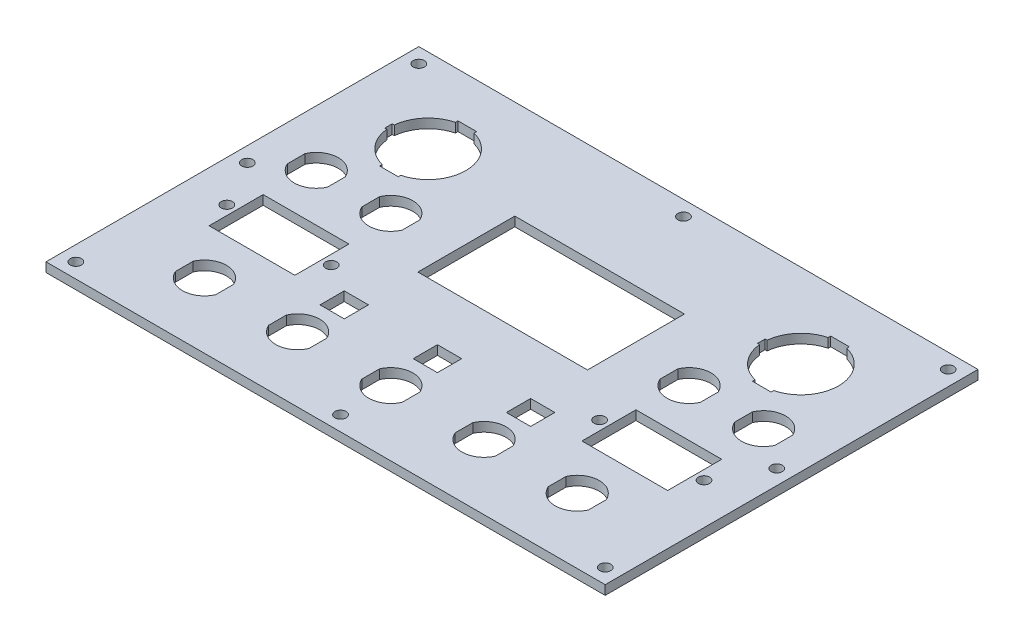
from build123d import *

# Parameters (mm, degrees)
SKETCH1_W            = 186.036212306
SKETCH1_H            = 300
BOSS_EXTRUDE1_DEPTH  = 2.5
CUT_EXTRUDE1_DEPTH   = 10
LPATTERN1_COUNT      = 5
LPATTERN1_PITCH      = 25
SKETCH3_W            = 23
SKETCH3_H            = 14.5
CUT_EXTRUDE2_DEPTH   = 10
SKETCH4_R            = 1.5
SKETCH4_W            = 23
SKETCH4_H            = 14.5
CUT_EXTRUDE3_DEPTH   = 10
SKETCH5_W            = 45.5
SKETCH5_H            = 26
CUT_EXTRUDE4_DEPTH   = 10
SKETCH6_W            = 6.5
SKETCH6_H            = 6.5
CUT_EXTRUDE5_DEPTH   = 5
LPATTERN2_COUNT      = 3
LPATTERN2_PITCH      = 25
CUT_EXTRUDE6_DEPTH   = 15
LPATTERN3_COUNT      = 2
LPATTERN3_PITCH      = 20
MIRROR2_COPY_1_DEPTH = 15
MIRROR2_COPY_2_DEPTH = 15
CUT_EXTRUDE8_DEPTH   = 15
SKETCH8_W            = 394.980605426
SKETCH8_H            = 443.90792121
SKETCH8_W_2          = 150
SKETCH8_H_2          = 100
CUT_EXTRUDE7_DEPTH   = 15
LPATTERN4_COUNT      = 2
LPATTERN4_PITCH      = 100
SKETCH10_R           = 1.5
CUT_EXTRUDE9_DEPTH   = 15
LPATTERN6_COUNT      = 3
LPATTERN6_PITCH      = 46


with BuildPart() as part:
    # Sketch1 → Boss-Extrude1 (new body)
    with BuildSketch(Plane(origin=(0, 0, 0), x_dir=(1, 0, 0), z_dir=(0, 1, 0))):
        Rectangle(SKETCH1_W, SKETCH1_H)
    extrude(amount=BOSS_EXTRUDE1_DEPTH)

    # Sketch2 → Cut-Extrude1 (cut)
    with BuildSketch(Plane(origin=(0, 2.5, 0), x_dir=(1, 0, 0), z_dir=(0, 1, 0))):
        with BuildLine():
            ThreePointArc((-55.4, -2.376972865), (-50, -5.9), (-44.6, -2.376972865))
            Line((-44.6, -2.376972865), (-44.6, 2.376972865))
            ThreePointArc((-44.6, 2.376972865), (-50, 5.9), (-55.4, 2.376972865))
            Line((-55.4, 2.376972865), (-55.4, -2.376972865))
        make_face()
    cut_extrude1 = extrude(amount=-CUT_EXTRUDE1_DEPTH, mode=Mode.SUBTRACT)

    # LPattern1: Cut-Extrude1 ×5
    with Locations(*[(i * LPATTERN1_PITCH, 0, 0) for i in range(1, LPATTERN1_COUNT)]):
        add(cut_extrude1, mode=Mode.SUBTRACT)

    # Sketch3 → Cut-Extrude2 (cut)
    with BuildSketch(Plane(origin=(0, 2.5, 0), x_dir=(-1, 0, 0), z_dir=(0, 1, 0))):
        with Locations((50, -20)):
            Rectangle(SKETCH3_W, SKETCH3_H)
    cut_extrude2 = extrude(amount=-CUT_EXTRUDE2_DEPTH, mode=Mode.SUBTRACT)

    # Sketch4 → Cut-Extrude3 (cut)
    with BuildSketch(Plane.XZ):
        with Locations((-64, -20)):
            Circle(SKETCH4_R)
        with Locations((-36, -20)):
            Circle(SKETCH4_R)
        with Locations((-50, -20)):
            Rectangle(SKETCH4_W, SKETCH4_H)
    cut_extrude3 = extrude(amount=-CUT_EXTRUDE3_DEPTH, mode=Mode.SUBTRACT)

    # Sketch5 → Cut-Extrude4 (cut)
    with BuildSketch(Plane(origin=(0, 2.5, 0), x_dir=(1, 0, 0), z_dir=(0, 1, 0))):
        with Locations((0, 43)):
            Rectangle(SKETCH5_W, SKETCH5_H)
    extrude(amount=-CUT_EXTRUDE4_DEPTH, mode=Mode.SUBTRACT)

    # Mirror1: Cut-Extrude2, Cut-Extrude3 across plane
    add(cut_extrude2.mirror(Plane(origin=(0, 0, 0), x_dir=(0, 0, 1), z_dir=(1, 0, 0))), mode=Mode.SUBTRACT)
    add(cut_extrude3.mirror(Plane(origin=(0, 0, 0), x_dir=(0, 0, 1), z_dir=(1, 0, 0))), mode=Mode.SUBTRACT)

    # Sketch6 → Cut-Extrude5 (cut)
    with BuildSketch(Plane(origin=(0, 2.5, 0), x_dir=(1, 0, 0), z_dir=(0, 1, 0))):
        with Locations((-25, 12.5)):
            Rectangle(SKETCH6_W, SKETCH6_H)
    cut_extrude5 = extrude(amount=-CUT_EXTRUDE5_DEPTH, mode=Mode.SUBTRACT)

    # LPattern2: Cut-Extrude5 ×3
    with Locations(*[(i * LPATTERN2_PITCH, 0, 0) for i in range(1, LPATTERN2_COUNT)]):
        add(cut_extrude5, mode=Mode.SUBTRACT)

    # Sketch7 → Cut-Extrude6 (cut)
    with BuildSketch(Plane(origin=(0, 2.5, 0), x_dir=(1, 0, 0), z_dir=(0, 1, 0))):
        with BuildLine():
            ThreePointArc((-45.4, 37.623027135), (-40, 34.1), (-34.6, 37.623027135))
            Line((-34.6, 37.623027135), (-34.6, 42.376972865))
            ThreePointArc((-34.6, 42.376972865), (-40, 45.9), (-45.4, 42.376972865))
            Line((-45.4, 42.376972865), (-45.4, 37.623027135))
        make_face()
    cut_extrude6 = extrude(amount=-CUT_EXTRUDE6_DEPTH, mode=Mode.SUBTRACT)

    # LPattern3: Cut-Extrude6 ×2
    with Locations(*[(-i * LPATTERN3_PITCH, 0, 0) for i in range(1, LPATTERN3_COUNT)]):
        add(cut_extrude6, mode=Mode.SUBTRACT)

    # Mirror2 copy 1 sketch → Mirror2 copy 1 (cut)
    with BuildSketch(Plane(origin=(20, 2.5, 0), x_dir=(-1, 0, 0), z_dir=(0, 1, 0))):
        with BuildLine():
            ThreePointArc((-45.4, -37.623027135), (-40, -34.1), (-34.6, -37.623027135))
            Line((-34.6, -37.623027135), (-34.6, -42.376972865))
            ThreePointArc((-34.6, -42.376972865), (-40, -45.9), (-45.4, -42.376972865))
            Line((-45.4, -42.376972865), (-45.4, -37.623027135))
        make_face()
    extrude(amount=-MIRROR2_COPY_1_DEPTH, mode=Mode.SUBTRACT)

    # Mirror2 copy 2 sketch → Mirror2 copy 2 (cut)
    with BuildSketch(Plane(origin=(0, 2.5, 0), x_dir=(-1, 0, 0), z_dir=(0, 1, 0))):
        with BuildLine():
            ThreePointArc((-45.4, -37.623027135), (-40, -34.1), (-34.6, -37.623027135))
            Line((-34.6, -37.623027135), (-34.6, -42.376972865))
            ThreePointArc((-34.6, -42.376972865), (-40, -45.9), (-45.4, -42.376972865))
            Line((-45.4, -42.376972865), (-45.4, -37.623027135))
        make_face()
    extrude(amount=-MIRROR2_COPY_2_DEPTH, mode=Mode.SUBTRACT)

    # Sketch9 → Cut-Extrude8 (cut)
    with BuildSketch(Plane(origin=(0, 2.5, 0), x_dir=(-1, 0, 0), z_dir=(0, 1, 0))):
        with BuildLine():
            Line((60.625, -61), (60.625, -59))
            Line((60.625, -59), (60.075496266, -59))
            ThreePointArc((60.075496266, -59), (57.677657877, -53.399303481), (52.5, -50.188495273))
            Line((52.5, -50.188495273), (52.5, -49.5))
            Line((52.5, -49.5), (47.5, -49.5))
            Line((47.5, -49.5), (47.5, -50.188495273))
            ThreePointArc((47.5, -50.188495273), (39.875, -60), (47.5, -69.811504727))
            Line((47.5, -69.811504727), (47.5, -70.5))
            Line((47.5, -70.5), (52.5, -70.5))
            Line((52.5, -70.5), (52.5, -69.811504727))
            ThreePointArc((52.5, -69.811504727), (57.677657877, -66.600696519), (60.075496266, -61))
            Line((60.075496266, -61), (60.625, -61))
        make_face()
    cut_extrude8 = extrude(amount=-CUT_EXTRUDE8_DEPTH, mode=Mode.SUBTRACT)

    # Sketch8 → Cut-Extrude7 (cut)
    with BuildSketch(Plane(origin=(0, 2.5, 0), x_dir=(1, 0, 0), z_dir=(0, 1, 0))):
        with Locations((0, 32.5)):
            Rectangle(SKETCH8_W, SKETCH8_H)
        with Locations((0, 32.5)):
            Rectangle(SKETCH8_W_2, SKETCH8_H_2, mode=Mode.SUBTRACT)
    extrude(amount=-CUT_EXTRUDE7_DEPTH, mode=Mode.SUBTRACT)

    # LPattern4: Cut-Extrude8 ×2
    with Locations(*[(i * LPATTERN4_PITCH, 0, 0) for i in range(1, LPATTERN4_COUNT)]):
        add(cut_extrude8, mode=Mode.SUBTRACT)

    # Sketch10 → Cut-Extrude9 (cut)
    with BuildSketch(Plane(origin=(0, 2.5, 0), x_dir=(1, 0, 0), z_dir=(0, 1, 0))):
        with Locations((-71, 78.5)):
            Circle(SKETCH10_R)
        with Locations((71, 78.5)):
            Circle(SKETCH10_R)
        with Locations((0, 78.5)):
            Circle(SKETCH10_R)
    cut_extrude9 = extrude(amount=-CUT_EXTRUDE9_DEPTH, mode=Mode.SUBTRACT)

    # LPattern6: Cut-Extrude9 ×3
    with Locations(*[(0, 0, i * LPATTERN6_PITCH) for i in range(1, LPATTERN6_COUNT)]):
        add(cut_extrude9, mode=Mode.SUBTRACT)


solid = part.part
